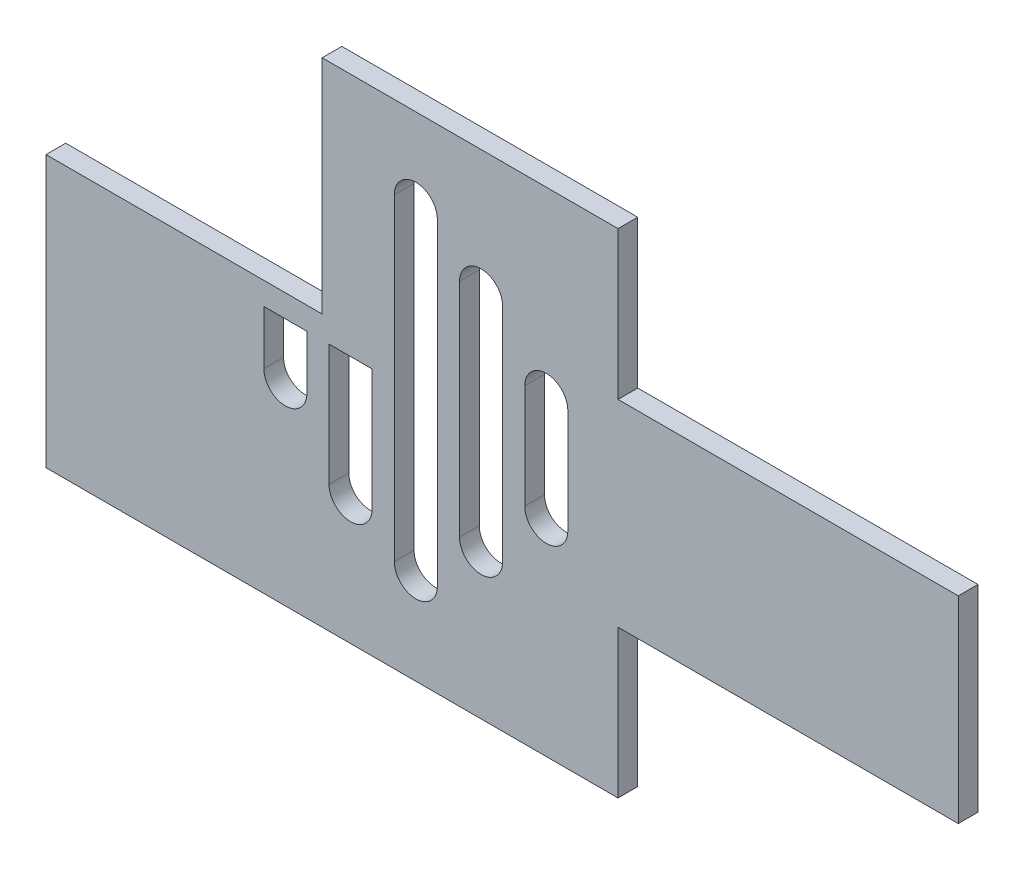
from build123d import *

# Parameters (mm, degrees)
BOSS_EXTRUDE1_DEPTH = 4


with BuildPart() as part:
    # Sketch1 → Boss-Extrude1 (new body)
    with BuildSketch(Plane.XY):
        Polygon((-19, 50), (-19, 5), (-75, 5), (-75, -50), (41, -50), (41, -20), (110, -20), (110, 20), (41, 20), (41, 50), align=None)
        with BuildLine():
            Line((4.364841143, 33.268336331), (4.364841143, -31.161160072))
            ThreePointArc((4.364841143, -31.161160072), (0, -35.526001215), (-4.364841143, -31.161160072))
            Line((-4.364841143, -31.161160072), (-4.364841143, 33.268336331))
            ThreePointArc((-4.364841143, 33.268336331), (0, 37.633177474), (4.364841143, 33.268336331))
        make_face(mode=Mode.SUBTRACT)
        with BuildLine():
            Line((17.594523423, 24.677736811), (17.594523423, -20.257706835))
            ThreePointArc((17.594523423, -20.257706835), (13.229682283, -24.622547975), (8.864841143, -20.257706835))
            Line((8.864841143, -20.257706835), (8.864841143, 24.677736811))
            ThreePointArc((8.864841143, 24.677736811), (13.229682283, 29.042577951), (17.594523423, 24.677736811))
        make_face(mode=Mode.SUBTRACT)
        with BuildLine():
            Line((30.824205703, 12.948264388), (30.824205703, -8.197826739))
            ThreePointArc((30.824205703, -8.197826739), (26.459364563, -12.562667879), (22.094523423, -8.197826739))
            Line((22.094523423, -8.197826739), (22.094523423, 12.948264388))
            ThreePointArc((22.094523423, 12.948264388), (26.459364563, 17.313105528), (30.824205703, 12.948264388))
        make_face(mode=Mode.SUBTRACT)
        with BuildLine():
            Line((-30.824205703, 0.416133702), (-22.094523423, 0.416133702))
            Line((-22.094523423, 0.416133702), (-22.094523423, -10.510680456))
            ThreePointArc((-22.094523423, -10.510680456), (-26.459364563, -14.875521596), (-30.824205703, -10.510680456))
            Line((-30.824205703, -10.510680456), (-30.824205703, 0.416133702))
        make_face(mode=Mode.SUBTRACT)
        with BuildLine():
            Line((-17.594523423, 0.416133702), (-8.864841143, 0.416133702))
            Line((-8.864841143, 0.416133702), (-8.864841143, -24.222598921))
            ThreePointArc((-8.864841143, -24.222598921), (-13.229682283, -28.587440061), (-17.594523423, -24.222598921))
            Line((-17.594523423, -24.222598921), (-17.594523423, 0.416133702))
        make_face(mode=Mode.SUBTRACT)
    extrude(amount=BOSS_EXTRUDE1_DEPTH)


solid = part.part
